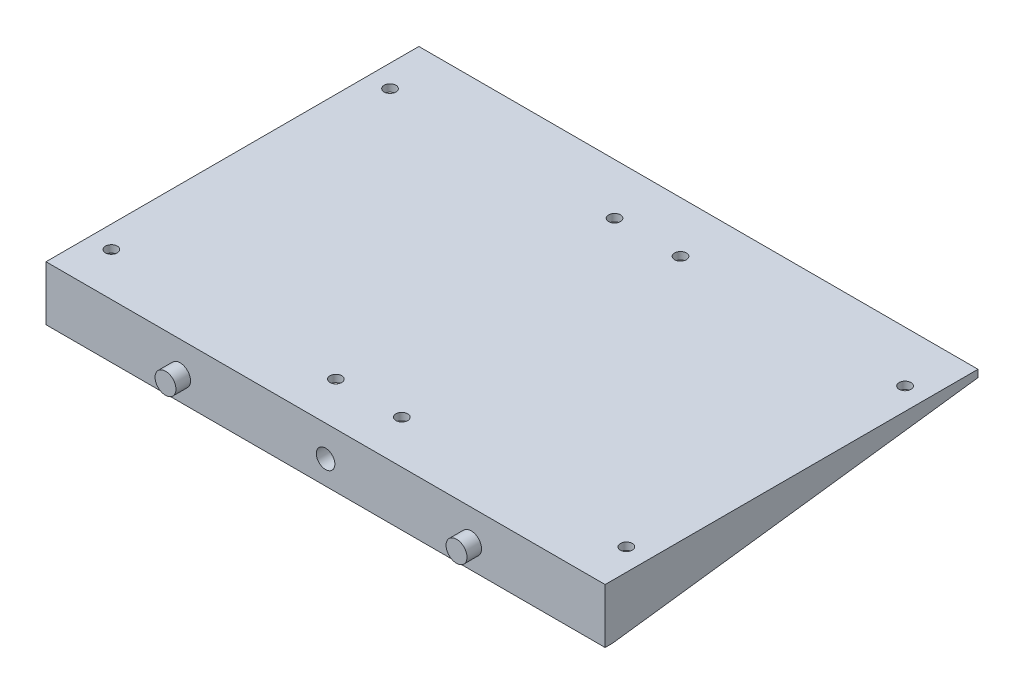
from build123d import *

# Parameters (mm, degrees)
SKETCH1_W           = 10
SKETCH1_H           = 100.5
SKETCH1_R           = 1.625
SKETCH1_W_2         = 69.85
BOSS_EXTRUDE1_DEPTH = 2
SKETCH3_W           = 149.7
SKETCH3_H           = 2
BOSS_EXTRUDE2_DEPTH = 2
SKETCH4_W           = 100.5
SKETCH4_H           = 2
BOSS_EXTRUDE3_DEPTH = 2
BOSS_EXTRUDE4_DEPTH = 2
SKETCH6_W           = 8
SKETCH6_H           = 15
BOSS_EXTRUDE5_DEPTH = 3
CUT_EXTRUDE1_DEPTH  = 10
FILLET1_R           = 3
CUT_EXTRUDE2_DEPTH  = 10
BOSS_EXTRUDE6_START = 3
SKETCH10_R          = 4
SKETCH10_R_2        = 2.55
BOSS_EXTRUDE6_DEPTH = 3
SKETCH12_R          = 2.875
BOSS_EXTRUDE7_DEPTH = 4
SKETCH13_W          = 10.946886228
SKETCH13_H          = 17.580383234
SKETCH13_W_2        = 10.296538922
SKETCH13_H_2        = 23.433508982
CUT_EXTRUDE3_DEPTH  = 43


with BuildPart() as part:
    # Sketch1 → Boss-Extrude1 (new body)
    # profile 1 of 3: a face of its own
    with BuildSketch(Plane(origin=(0, 0, 0), x_dir=(1, 0, 0), z_dir=(0, 1, 0))):
        with Locations((74.85, 50.25)):
            Rectangle(SKETCH1_W, SKETCH1_H)
    # profile 2 of 3: a face of its own
    with BuildSketch(Plane(origin=(0, 0, 0), x_dir=(1, 0, 0), z_dir=(0, 1, 0))):
        Polygon((0, 0), (69.85, 0), (69.85, 100.5), (0, 100.5), (0, 86.5), align=None)
        with Locations(Location((4.07, 9.9, 0), (0, 0, 270))):
            Circle(SKETCH1_R, mode=Mode.SUBTRACT)
        with BuildLine():
            ThreePointArc((64.165, 9.9), (64.640951481, 11.049048519), (65.79, 11.525))
            ThreePointArc((65.79, 11.525), (66.939048519, 11.049048519), (67.415, 9.9))
            ThreePointArc((67.415, 9.9), (65.79, 8.275), (64.165, 9.9))
        make_face(mode=Mode.SUBTRACT)
        with BuildLine():
            ThreePointArc((5.695, 86.5), (4.07, 84.875), (2.445, 86.5))
            ThreePointArc((2.445, 86.5), (4.07, 88.125), (5.695, 86.5))
        make_face(mode=Mode.SUBTRACT)
        with BuildLine():
            ThreePointArc((65.79, 84.875), (64.640951481, 85.350951481), (64.165, 86.5))
            ThreePointArc((64.165, 86.5), (65.79, 88.125), (67.415, 86.5))
            ThreePointArc((67.415, 86.5), (66.939048519, 85.350951481), (65.79, 84.875))
        make_face(mode=Mode.SUBTRACT)
    # profile 3 of 3: a face of its own
    with BuildSketch(Plane(origin=(0, 0, 0), x_dir=(1, 0, 0), z_dir=(0, 1, 0))):
        with Locations((114.775, 50.25)):
            Rectangle(SKETCH1_W_2, SKETCH1_H)
        with Locations(Location((83.92, 9.9, 0), (0, 0, 270))):
            Circle(SKETCH1_R, mode=Mode.SUBTRACT)
        with Locations(Location((145.64, 9.9, 0), (0, 0, 270))):
            Circle(SKETCH1_R, mode=Mode.SUBTRACT)
        with Locations(Location((83.92, 86.5, 0), (0, 0, 270))):
            Circle(SKETCH1_R, mode=Mode.SUBTRACT)
        with Locations(Location((145.64, 86.5, 0), (0, 0, 270))):
            Circle(SKETCH1_R, mode=Mode.SUBTRACT)
    extrude(amount=BOSS_EXTRUDE1_DEPTH)

    # Sketch3 → Boss-Extrude2 (add)
    with BuildSketch(Plane.XY):
        Polygon((-10, 2), (-10, -13), (159.7, -13), (159.7, 2), (149.7, 2), (149.7, 0), (0, 0), (0, 2), align=None)
        with Locations((74.85, 1)):
            Rectangle(SKETCH3_W, SKETCH3_H)
    extrude(amount=BOSS_EXTRUDE2_DEPTH)

    # Sketch4 → Boss-Extrude3 (add)
    with BuildSketch(Plane.ZY):
        Polygon((0, 0), (-100.5, 0), (0, -13), align=None)
        with Locations((-50.25, 1)):
            Rectangle(SKETCH4_W, SKETCH4_H)
    extrude(amount=BOSS_EXTRUDE3_DEPTH)

    # Sketch5 → Boss-Extrude4 (add)
    with BuildSketch(Plane(origin=(149.7, 0, 0), x_dir=(0, 0, -1), z_dir=(1, 0, 0))):
        Polygon((100.5, 0), (0, -13), (0, 2), (100.5, 2), align=None)
    extrude(amount=BOSS_EXTRUDE4_DEPTH)

    # Sketch6 → Boss-Extrude5 (add)
    with BuildSketch(Plane(origin=(0, 0, 0), x_dir=(-1, 0, 0), z_dir=(0, 0, -1))):
        with Locations((6, -5.5)):
            Rectangle(SKETCH6_W, SKETCH6_H)
        with Locations((-155.7, -5.5)):
            Rectangle(SKETCH6_W, SKETCH6_H)
    extrude(amount=BOSS_EXTRUDE5_DEPTH)

    # Sketch8 → Cut-Extrude1 (cut)
    with BuildSketch(Plane(origin=(0, 0, -3), x_dir=(-1, 0, 0), z_dir=(0, 0, -1))):
        with BuildLine():
            ThreePointArc((-153.15, -5.5), (-155.7, -2.95), (-158.25, -5.5))
            Line((-158.25, -5.5), (-153.15, -5.5))
        make_face()
        with BuildLine():
            Line((-153.15, -5.5), (-158.25, -5.5))
            ThreePointArc((-158.25, -5.5), (-155.7, -8.05), (-153.15, -5.5))
        make_face()
        with BuildLine():
            ThreePointArc((3.45, -5.5), (6, -8.05), (8.55, -5.5))
            Line((8.55, -5.5), (3.45, -5.5))
        make_face()
        with BuildLine():
            Line((3.45, -5.5), (8.55, -5.5))
            ThreePointArc((8.55, -5.5), (6, -2.95), (3.45, -5.5))
        make_face()
    extrude(amount=-CUT_EXTRUDE1_DEPTH, mode=Mode.SUBTRACT)

    # Fillet1
    fillet1_edges = [part.edges().sort_by_distance(p)[0] for p in [
        (159.7, 2, -0.5),
        (-10, 2, -0.5),
        (-10, -13, -0.5),
        (159.7, -13, -0.5),
    ]]
    fillet(fillet1_edges, radius=FILLET1_R)

    # Sketch9 → Cut-Extrude2 (cut)
    with BuildSketch(Plane(origin=(0, 0, 0), x_dir=(-1, 0, 0), z_dir=(0, 0, -1))):
        with BuildLine():
            ThreePointArc((-72.3, -6.5), (-73.046877708, -4.696877708), (-74.85, -3.95))
            Line((-74.85, -3.95), (-74.85, -9.05))
            ThreePointArc((-74.85, -9.05), (-73.046877708, -8.303122292), (-72.3, -6.5))
        make_face()
        with BuildLine():
            Line((-74.85, -9.05), (-74.85, -3.95))
            ThreePointArc((-74.85, -3.95), (-77.4, -6.5), (-74.85, -9.05))
        make_face()
    extrude(amount=-CUT_EXTRUDE2_DEPTH, mode=Mode.SUBTRACT)

    # Sketch10 → Boss-Extrude6 (add)
    with BuildSketch(Plane(origin=(0, 0, 0), x_dir=(-1, 0, 0), z_dir=(0, 0, -1)).offset(BOSS_EXTRUDE6_START)):
        with Locations(Location((-74.85, -6.5, 0), (0, 0, 180))):
            Circle(SKETCH10_R)
        with Locations((-74.85, -6.5)):
            Circle(SKETCH10_R_2, mode=Mode.SUBTRACT)
    extrude(amount=-BOSS_EXTRUDE6_DEPTH)

    # Sketch12 → Boss-Extrude7 (add)
    with BuildSketch(Plane.XY.offset(2)):
        with Locations((34.85, -6.5)):
            Circle(SKETCH12_R)
        with Locations((114.85, -6.5)):
            Circle(SKETCH12_R)
    extrude(amount=BOSS_EXTRUDE7_DEPTH)

    # Sketch13 → Cut-Extrude3 (cut)
    with BuildSketch(Plane(origin=(0, 0, -3), x_dir=(-1, 0, 0), z_dir=(0, 0, -1))):
        with Locations((-157.173443114, -6.790191617)):
            Rectangle(SKETCH13_W, SKETCH13_H)
        with Locations((7.148269461, -9.716754491)):
            Rectangle(SKETCH13_W_2, SKETCH13_H_2)
    extrude(amount=-CUT_EXTRUDE3_DEPTH, mode=Mode.SUBTRACT)


solid = part.part
